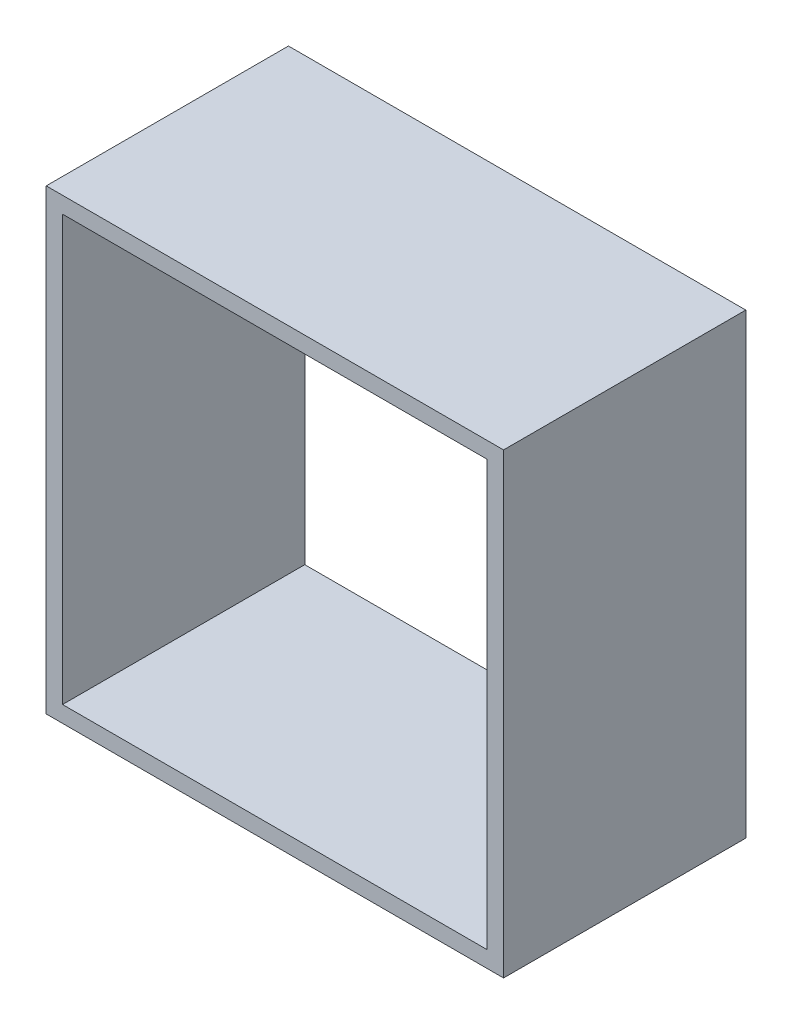
from build123d import *

# Parameters (mm, degrees)
ESQUISSE2_W             = 28
ESQUISSE2_H             = 28
BOSS_EXTRU_1_DEPTH      = 14.83
ESQUISSE3_W             = 26
ESQUISSE3_H             = 26
ENL_V_MAT_EXTRU_1_DEPTH = 50


with BuildPart() as part:
    # Esquisse2 → Boss.-Extru.1 (new body)
    with BuildSketch(Plane.XY):
        Rectangle(ESQUISSE2_W, ESQUISSE2_H)
    extrude(amount=BOSS_EXTRU_1_DEPTH)

    # Esquisse3 → Enlèv. mat.-Extru.1 (cut)
    with BuildSketch(Plane.XY.offset(14.83)):
        Rectangle(ESQUISSE3_W, ESQUISSE3_H)
    extrude(amount=-ENL_V_MAT_EXTRU_1_DEPTH, mode=Mode.SUBTRACT)


solid = part.part
